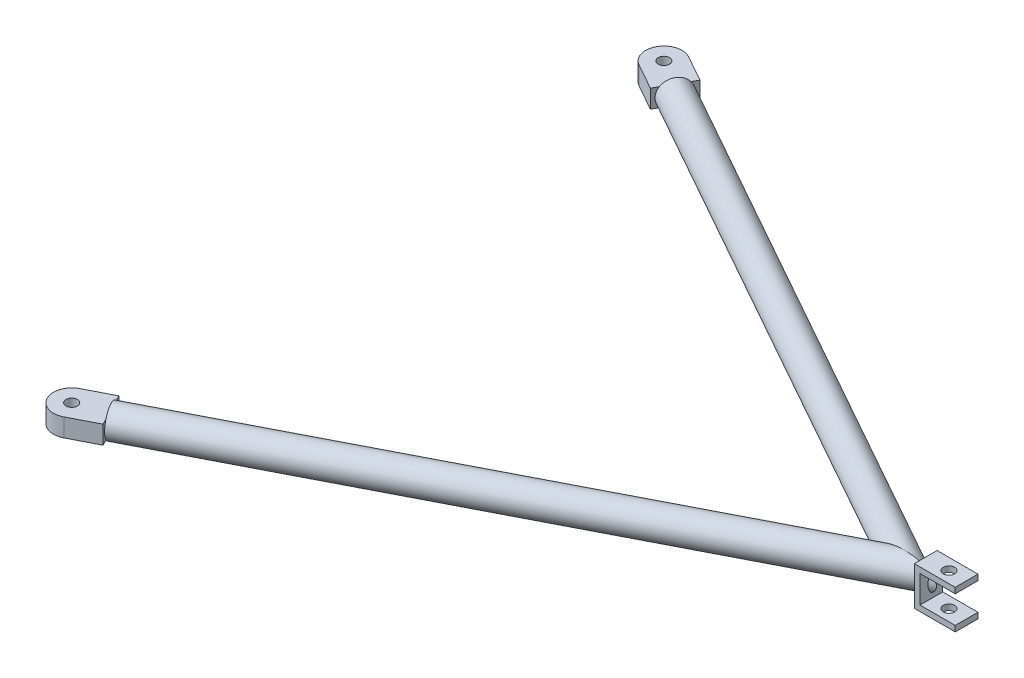
from build123d import *

# Parameters (mm, degrees)
SKETCH2_R                   = 8.255
BOSS_EXTRUDE1_DEPTH         = 6.35
BOSS_EXTRUDE1_DEPTH_BACK    = 6.35
BOSS_EXTRUDE2_DEPTH         = 10.16
BOSS_EXTRUDE2_DEPTH_BACK    = 16.256
SKETCH4_W                   = 20.32
SKETCH4_H                   = 10.16
BOSS_EXTRUDE3_DEPTH         = 10.16
BOSS_EXTRUDE3_DEPTH_BACK    = 16.51
SKETCH5_W                   = 20.32
SKETCH5_H                   = 10.16
CUT_EXTRUDE1_DEPTH          = 372.505050517
CUT_EXTRUDE2_DEPTH          = 370.547039673
CUT_EXTRUDE3_START          = -16.256
CUT_EXTRUDE3_DEPTH          = 16.256
CUT_EXTRUDE4_DEPTH          = 16.51
E_0_25_DIAMETER_HOLE1_D     = 6.35
E_0_25_DIAMETER_HOLE1_DEPTH = 19.05
E_0_25_DIAMETER_HOLE1_TIP   = 1.907732465
CUT_EXTRUDE5_DEPTH          = 367.61301524
CUT_EXTRUDE5_DEPTH_BACK     = 367.61301524
SKETCH13_R                  = 3.175


with BuildPart() as part:
    # Sweep1: sweep along a path in Sketch1
    with BuildLine(Plane(origin=(0, 0, 0), x_dir=(1, 0, 0), z_dir=(0, 1, 0))) as sweep1_path:
        Line((-307.263447944, -157.854259231), (0, 0))
        Line((0, 0), (-307.263447944, 172.345740769))
    # Sketch2 → Sweep1 (sweep)
    with BuildSketch(Plane(origin=(-307.263447944, 0, 157.854259231), x_dir=(-0.45696578054298637, 0, -0.8894842749665333), z_dir=(0.8894842749665333, 0, -0.45696578054298637))):
        Circle(SKETCH2_R)
    sweep(path=sweep1_path.line, transition=Transition.RIGHT)

    # Sketch3 → Boss-Extrude1 (add, two sides: drawn at the far end of the back side and taken through both)
    with BuildSketch(Plane.XY.offset(-BOSS_EXTRUDE1_DEPTH_BACK)):
        Polygon((33.931753368, 10.795), (11.09345, 10.795), (11.09345, -10.795), (33.931753368, -10.795), (33.931753368, -7.62), (14.26845, -7.62), (14.26845, 7.62), (33.931753368, 7.62), align=None)
    extrude(amount=BOSS_EXTRUDE1_DEPTH + BOSS_EXTRUDE1_DEPTH_BACK)

    # Sketch4 → Boss-Extrude2 (add, two sides: drawn at the far end of the back side and taken through both)
    with BuildSketch(Plane(origin=(-307.263447944, 0, 157.854259231), x_dir=(0.45696578054298637, 0, 0.8894842749665333), z_dir=(-0.8894842749665333, 0, 0.45696578054298637)).offset(-BOSS_EXTRUDE2_DEPTH_BACK)):
        Rectangle(SKETCH4_W, SKETCH4_H)
    extrude(amount=BOSS_EXTRUDE2_DEPTH + BOSS_EXTRUDE2_DEPTH_BACK)

    # Sketch5 → Boss-Extrude3 (add, two sides: drawn at the far end of the back side and taken through both)
    with BuildSketch(Plane(origin=(-307.263447944, 0, -172.345740769), x_dir=(-0.4892044257112748, 0, 0.8721691520940774), z_dir=(-0.8721691520940774, 0, -0.4892044257112748)).offset(-BOSS_EXTRUDE3_DEPTH_BACK)):
        Rectangle(SKETCH5_W, SKETCH5_H)
    extrude(amount=BOSS_EXTRUDE3_DEPTH + BOSS_EXTRUDE3_DEPTH_BACK)

    # Sketch6 → Cut-Extrude1 (cut, through all)
    with BuildSketch(Plane(origin=(0, 5.08, 0), x_dir=(1, 0, 0), z_dir=(0, 1, 0))):
        with BuildLine():
            Line((-312.23376491, 163.484502184), (-321.095003495, 168.454819149))
            Line((-321.095003495, 168.454819149), (-316.12468653, 177.316057734))
            ThreePointArc((-316.12468653, 177.316057734), (-317.043834669, 169.594443707), (-312.23376491, 163.484502184))
        make_face()
    cut_extrude1 = extrude(amount=-CUT_EXTRUDE1_DEPTH, mode=Mode.SUBTRACT)

    # Mirror1: Cut-Extrude1 across plane
    add(cut_extrude1.mirror(Plane(origin=(0, 0, 0), x_dir=(0.8721691520940776, 0, 0.48920442571127426), z_dir=(-0.4892044257112748, 0, 0.8721691520940775))), mode=Mode.SUBTRACT)

    # Sketch7 → Cut-Extrude2 (cut, through all)
    with BuildSketch(Plane(origin=(0, 5.08, 0), x_dir=(1, 0, 0), z_dir=(0, 1, 0))):
        with BuildLine():
            Line((-302.620675614, -166.891419464), (-311.657835848, -171.534191795))
            Line((-311.657835848, -171.534191795), (-316.300608178, -162.497031561))
            ThreePointArc((-316.300608178, -162.497031561), (-310.37074943, -167.527432313), (-302.620675614, -166.891419464))
        make_face()
    cut_extrude2 = extrude(amount=-CUT_EXTRUDE2_DEPTH, mode=Mode.SUBTRACT)

    # Mirror2: Cut-Extrude2 across plane
    add(cut_extrude2.mirror(Plane(origin=(0, 0, 0), x_dir=(-0.8894842749665333, 0, 0.45696578054298614), z_dir=(0.45696578054298637, 0, 0.8894842749665333))), mode=Mode.SUBTRACT)

    # Sketch8 → Cut-Extrude3 (cut)
    with BuildSketch(Plane(origin=(-307.263447944, 0, 157.854259231), x_dir=(0.45696578054298637, 0, 0.8894842749665333), z_dir=(-0.8894842749665333, 0, 0.45696578054298637)).offset(CUT_EXTRUDE3_START)):
        with BuildLine():
            Line((6.506813736, -5.08), (-6.506813736, -5.08))
            ThreePointArc((-6.506813736, -5.08), (0, -8.255), (6.506813736, -5.08))
        make_face()
        with BuildLine():
            Line((-6.506813736, 5.08), (6.506813736, 5.08))
            ThreePointArc((6.506813736, 5.08), (0, 8.255), (-6.506813736, 5.08))
        make_face()
    extrude(amount=CUT_EXTRUDE3_DEPTH, mode=Mode.SUBTRACT)

    # Sketch9 → Cut-Extrude4 (cut)
    with BuildSketch(Plane(origin=(-307.263447944, 0, -172.345740769), x_dir=(-0.4892044257112748, 0, 0.8721691520940774), z_dir=(-0.8721691520940774, 0, -0.4892044257112748))):
        with BuildLine():
            Line((6.506813736, -5.08), (-6.506813736, -5.08))
            ThreePointArc((-6.506813736, -5.08), (0, -8.255), (6.506813736, -5.08))
        make_face()
        with BuildLine():
            Line((-6.506813736, 5.08), (6.506813736, 5.08))
            ThreePointArc((6.506813736, 5.08), (0, 8.255), (-6.506813736, 5.08))
        make_face()
    extrude(amount=-CUT_EXTRUDE4_DEPTH, mode=Mode.SUBTRACT)

    # E (0.25) Diameter Hole1
    with Locations(Plane(origin=(-307.263447944, 5.08, -172.345740769), x_dir=(0, 0, 1), z_dir=(0, 1, 0))):
        with Locations((0, 0), (330.2, 0)):
            Hole(E_0_25_DIAMETER_HOLE1_D / 2, depth=E_0_25_DIAMETER_HOLE1_DEPTH)
            with Locations((0, 0, -(E_0_25_DIAMETER_HOLE1_DEPTH + E_0_25_DIAMETER_HOLE1_TIP / 2))):  # 118° drill point
                Cone(0, E_0_25_DIAMETER_HOLE1_D / 2, E_0_25_DIAMETER_HOLE1_TIP, mode=Mode.SUBTRACT)

    # Sketch13 → Cut-Extrude5 (cut, two sides: drawn at the far end of the back side and taken through both)
    with BuildSketch(Plane(origin=(0, -7.62, 0), x_dir=(1, 0, 0), z_dir=(0, 1, 0)).offset(-CUT_EXTRUDE5_DEPTH_BACK)):
        with Locations(Location((24.100101684, 0, 0), (0, 0, 180))):
            Circle(SKETCH13_R)
    extrude(amount=CUT_EXTRUDE5_DEPTH + CUT_EXTRUDE5_DEPTH_BACK, mode=Mode.SUBTRACT)


solid = part.part
